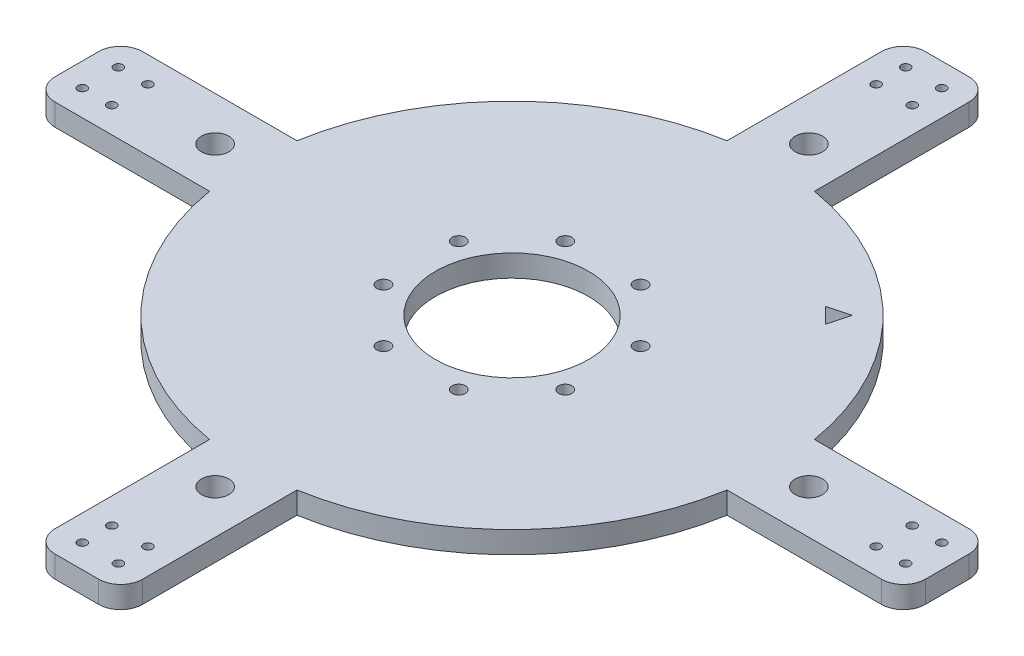
from build123d import *

# Parameters (mm, degrees)
SKETCH1_R           = 200
BOSS_EXTRUDE1_DEPTH = 10
SKETCH2_R           = 6.25
CUT_EXTRUDE1_DEPTH  = 284.019433962
SKETCH3_R           = 35
CUT_EXTRUDE2_DEPTH  = 284.019433962
SKETCH4_R           = 3.05
CUT_EXTRUDE3_DEPTH  = 284.019433962
CIRPATTERN1_COUNT   = 8
SKETCH5_R           = 2.05
CUT_EXTRUDE4_DEPTH  = 284.019433962
CIRPATTERN2_COUNT   = 4
CUT_EXTRUDE5_START  = -10
CUT_EXTRUDE5_DEPTH  = 10
CIRPATTERN3_COUNT   = 4
FILLET1_R           = 10
CUT_EXTRUDE6_DEPTH  = 282.602556807


with BuildPart() as part:
    # Sketch1 → Boss-Extrude1 (new body)
    with BuildSketch(Plane(origin=(0, 0, 0), x_dir=(1, 0, 0), z_dir=(0, 1, 0))):
        with Locations(Location((0, 0, 0), (0, 0, 270))):
            Circle(SKETCH1_R)
    extrude(amount=BOSS_EXTRUDE1_DEPTH)

    # Sketch2 → Cut-Extrude1 (cut, through all)
    with BuildSketch(Plane(origin=(0, 10, 0), x_dir=(1, 0, 0), z_dir=(0, 1, 0))):
        with Locations(Location((-135.764501988, 0, 0), (0, 0, 270))):
            Circle(SKETCH2_R)
        with Locations(Location((0, -135.764501988, 0), (0, 0, 270))):
            Circle(SKETCH2_R)
        with Locations(Location((135.764501988, 0, 0), (0, 0, 270))):
            Circle(SKETCH2_R)
        with Locations(Location((0, 135.764501988, 0), (0, 0, 270))):
            Circle(SKETCH2_R)
    extrude(amount=-CUT_EXTRUDE1_DEPTH, mode=Mode.SUBTRACT)

    # Sketch3 → Cut-Extrude2 (cut, through all)
    with BuildSketch(Plane(origin=(0, 10, 0), x_dir=(1, 0, 0), z_dir=(0, 1, 0))):
        with Locations(Location((0, 0, 0), (0, 0, 270))):
            Circle(SKETCH3_R)
    extrude(amount=-CUT_EXTRUDE2_DEPTH, mode=Mode.SUBTRACT)

    # Sketch4 → Cut-Extrude3 (cut, through all)
    with BuildSketch(Plane(origin=(0, 10, 0), x_dir=(1, 0, 0), z_dir=(0, 1, 0))):
        with Locations(Location((17.220754456, 41.574578963, 0), (0, 0, 270))):
            Circle(SKETCH4_R)
    cut_extrude3 = extrude(amount=-CUT_EXTRUDE3_DEPTH, mode=Mode.SUBTRACT)

    # CirPattern1: Cut-Extrude3 ×8 about axis
    cirpattern1_axis = Axis((0, 0, 0), (0, 1, 0))
    for i in range(1, CIRPATTERN1_COUNT):
        add(cut_extrude3.rotate(cirpattern1_axis, i * 360 / CIRPATTERN1_COUNT), mode=Mode.SUBTRACT)

    # Sketch5 → Cut-Extrude4 (cut, through all)
    with BuildSketch(Plane(origin=(0, 10, 0), x_dir=(1, 0, 0), z_dir=(0, 1, 0))):
        with Locations(Location((-188.264501988, 8.25, 0), (0, 0, 270))):
            Circle(SKETCH5_R)
        with Locations(Location((-174.764501988, 8.25, 0), (0, 0, 270))):
            Circle(SKETCH5_R)
        with Locations(Location((-174.764501988, -8.25, 0), (0, 0, 270))):
            Circle(SKETCH5_R)
        with Locations(Location((-188.264501988, -8.25, 0), (0, 0, 270))):
            Circle(SKETCH5_R)
    cut_extrude4 = extrude(amount=-CUT_EXTRUDE4_DEPTH, mode=Mode.SUBTRACT)

    # CirPattern2: Cut-Extrude4 ×4 about axis
    cirpattern2_axis = Axis((0, 0, 0), (0, 1, 0))
    for i in range(1, CIRPATTERN2_COUNT):
        add(cut_extrude4.rotate(cirpattern2_axis, i * 360 / CIRPATTERN2_COUNT), mode=Mode.SUBTRACT)

    # Sketch6 → Cut-Extrude5 (cut)
    with BuildSketch(Plane(origin=(0, 10, 0), x_dir=(1, 0, 0), z_dir=(0, 1, 0)).offset(CUT_EXTRUDE5_START)):
        with BuildLine():
            Line((-198.997487421, 20), (-118.321595662, 20))
            ThreePointArc((-118.321595662, 20), (-84.852813742, 84.852813742), (-20, 118.321595662))
            Line((-20, 118.321595662), (-20, 198.997487421))
            ThreePointArc((-20, 198.997487421), (-141.421356237, 141.421356237), (-198.997487421, 20))
        make_face()
        with BuildLine():
            Line((-198.997487421, -20), (-198.997487421, 20))
            ThreePointArc((-198.997487421, 20), (-200, 0), (-198.997487421, -20))
        make_face()
    cut_extrude5 = extrude(amount=CUT_EXTRUDE5_DEPTH, mode=Mode.SUBTRACT)

    # CirPattern3: Cut-Extrude5 ×4 about axis
    cirpattern3_axis = Axis((0, 0, 0), (0, 1, 0))
    for i in range(1, CIRPATTERN3_COUNT):
        add(cut_extrude5.rotate(cirpattern3_axis, i * 360 / CIRPATTERN3_COUNT), mode=Mode.SUBTRACT)

    # Fillet1
    fillet1_edges = [part.edges().sort_by_distance(p)[0] for p in [
        (-198.997487421, 5, -20),
        (-20, 5, -198.997487421),
        (-198.997487421, 5, 20),
        (20, 5, -198.997487421),
        (198.997487421, 5, -20),
        (198.997487421, 5, 20),
        (20, 5, 198.997487421),
        (-20, 5, 198.997487421),
    ]]
    fillet(fillet1_edges, radius=FILLET1_R)

    # Sketch7 → Cut-Extrude6 (cut, through all)
    with BuildSketch(Plane(origin=(0, 10, 0), x_dir=(1, 0, 0), z_dir=(0, 1, 0))):
        Polygon((77.781745931, 77.781745931), (68.122487668, 75.193555479), (75.193555479, 68.122487668), align=None)
    extrude(amount=-CUT_EXTRUDE6_DEPTH, mode=Mode.SUBTRACT)


solid = part.part
